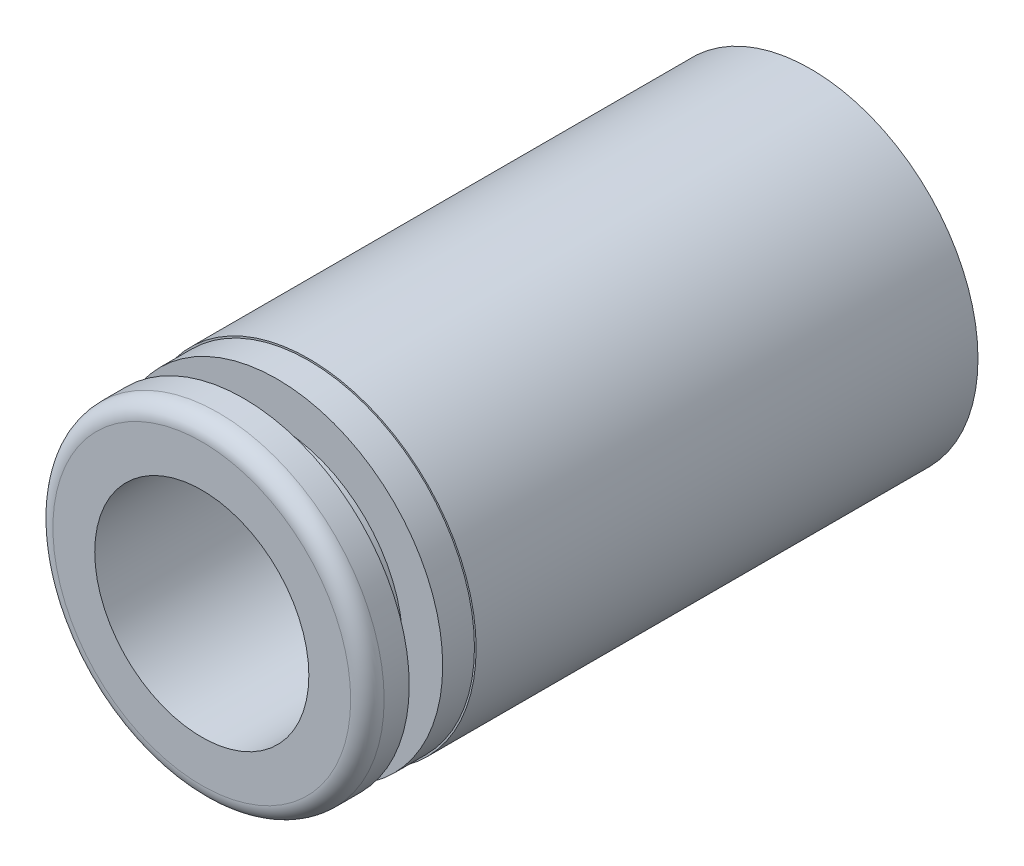
from build123d import *

# Parameters (mm, degrees)
INSERT_SKETCH_R       = 5
INSERT_SKETCH_R_2     = 3.2
INSERT_DEPTH          = 15
SKETCH2_R             = 4.95
SKETCH2_R_2           = 3.2
CHUCK_SHOULDER_DEPTH  = 0.95
SKETCH4_R             = 3.75
SKETCH4_R_2           = 3.2
CHUCK_MINOR_DIA_DEPTH = 1
SKETCH5_R             = 4.95
SKETCH5_R_2           = 3.2
CHUCK_TOP_DEPTH       = 1.25
CHUCK_TOP_FILLET_R    = 0.5


with BuildPart() as part:
    # Insert Sketch → Insert (new body)
    with BuildSketch(Plane.XY):
        Circle(INSERT_SKETCH_R)
        Circle(INSERT_SKETCH_R_2, mode=Mode.SUBTRACT)
    extrude(amount=INSERT_DEPTH)

    # Sketch2 → chuck shoulder (add)
    with BuildSketch(Plane.XY.offset(15)):
        with Locations(Location((0, 0, 0), (0, 0, 180))):
            Circle(SKETCH2_R)
        Circle(SKETCH2_R_2, mode=Mode.SUBTRACT)
    extrude(amount=CHUCK_SHOULDER_DEPTH)

    # Sketch4 → chuck minor dia (add)
    with BuildSketch(Plane.XY.offset(15.95)):
        Circle(SKETCH4_R)
        Circle(SKETCH4_R_2, mode=Mode.SUBTRACT)
    extrude(amount=CHUCK_MINOR_DIA_DEPTH)

    # Sketch5 → chuck top (add)
    with BuildSketch(Plane.XY.offset(16.95)):
        with Locations(Location((0, 0, 0), (0, 0, 180))):
            Circle(SKETCH5_R)
        Circle(SKETCH5_R_2, mode=Mode.SUBTRACT)
    extrude(amount=CHUCK_TOP_DEPTH)

    # chuck top fillet
    chuck_top_fillet_edges = [part.edges().sort_by_distance(p)[0] for p in [
        (4.95, 0, 18.2),
    ]]
    fillet(chuck_top_fillet_edges, radius=CHUCK_TOP_FILLET_R)


solid = part.part
